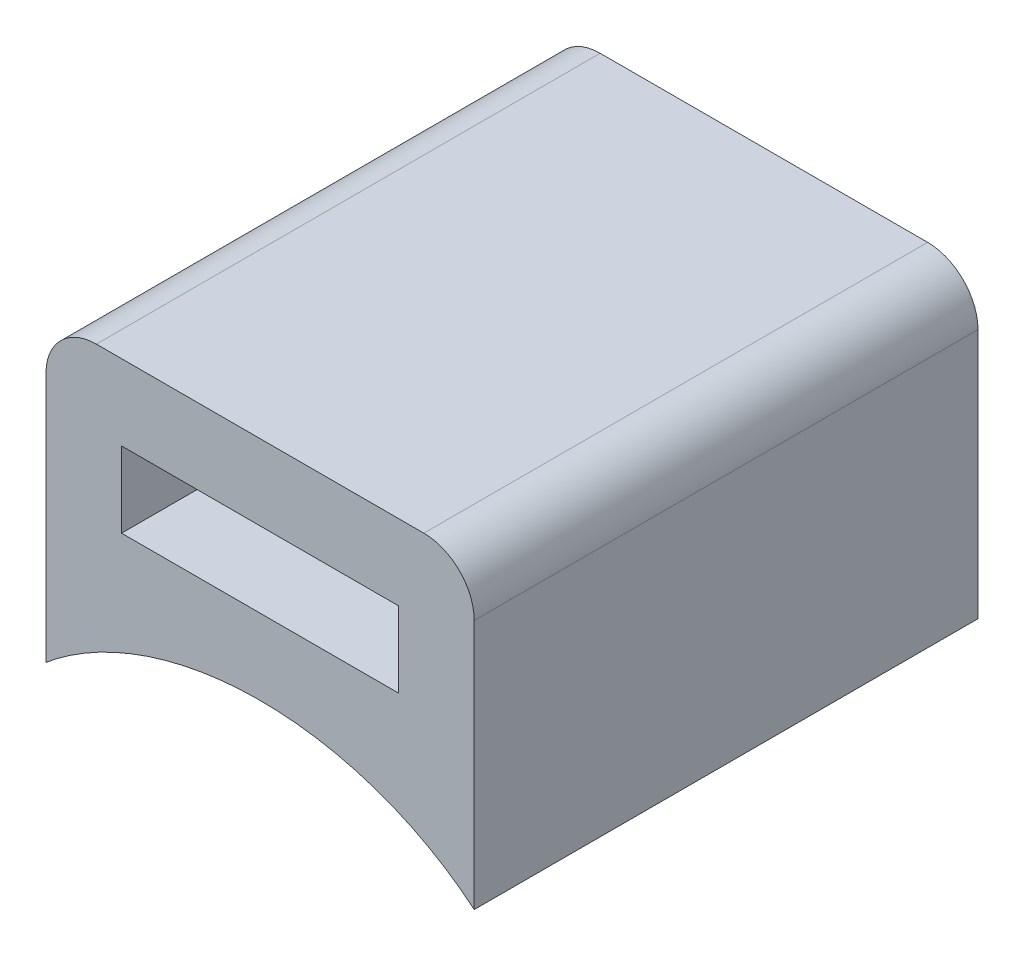
from build123d import *

# Parameters (mm, degrees)
SKETCH1_W           = 6.985
SKETCH1_H           = 1.905
BOSS_EXTRUDE1_DEPTH = 12.7
FILLET1_R           = 1.27


with BuildPart() as part:
    # Sketch1 → Boss-Extrude1 (new body)
    with BuildSketch(Plane.XY):
        with BuildLine():
            add(Edge.make_bspline(
                [(5.3975, 4.482325921), (0, 8.995887562), (-5.3975, 4.482325921)],
                knots=[3.925254702, 3.925254702, 3.925254702, 5.499523258, 5.499523258, 5.499523258], degree=2, weights=[1, 0.705878098, 1]))
            Line((5.3975, 4.482325921), (5.3975, 12.065))
            Line((5.3975, 12.065), (-5.3975, 12.065))
            Line((-5.3975, 12.065), (-5.3975, 4.482325921))
        make_face()
        with Locations((0, 9.2075)):
            Rectangle(SKETCH1_W, SKETCH1_H, mode=Mode.SUBTRACT)
    extrude(amount=BOSS_EXTRUDE1_DEPTH)

    # Fillet1
    fillet1_edges = [part.edges().sort_by_distance(p)[0] for p in [
        (-5.3975, 12.065, 6.35),
        (5.3975, 12.065, 6.35),
    ]]
    fillet(fillet1_edges, radius=FILLET1_R)


solid = part.part
